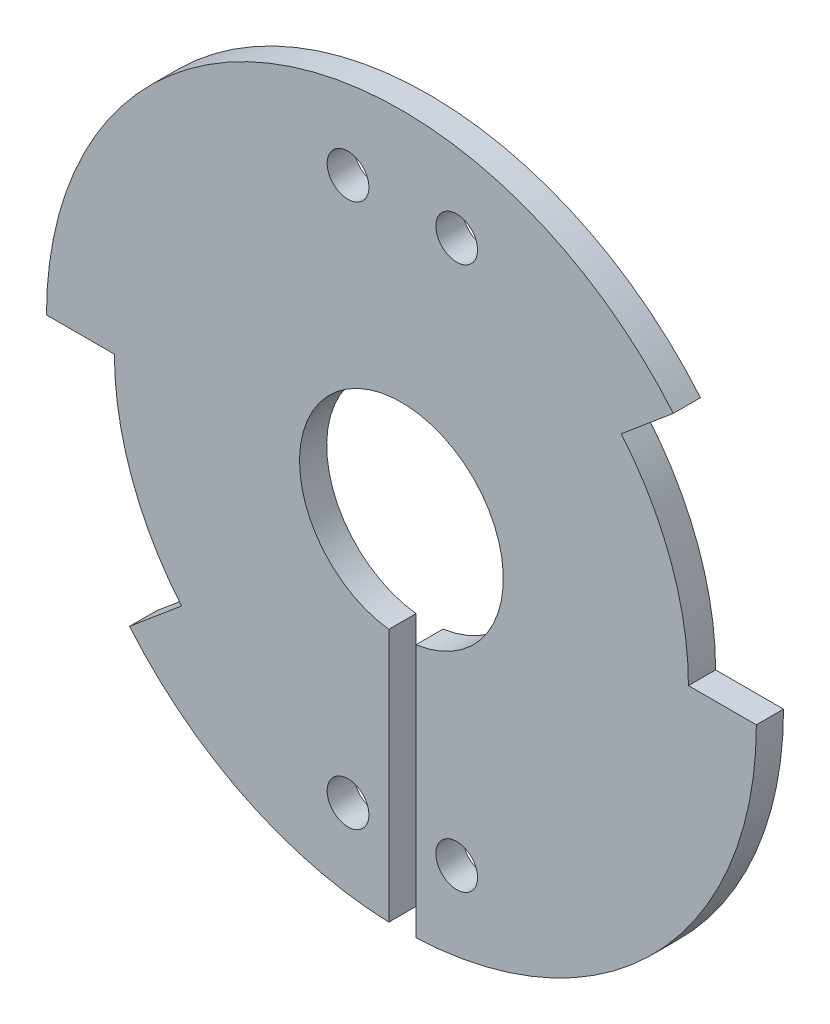
from build123d import *

# Parameters (mm, degrees)
SKETCH1_R           = 66.3575
BOSS_EXTRUDE1_DEPTH = 5.08
CUT_EXTRUDE1_REACH  = 95.981
SKETCH3_R           = 19.05
CUT_EXTRUDE2_REACH  = 95.981
SKETCH3_4_W         = 5.08
SKETCH3_4_H         = 59.193573399
SKETCH3_4_R         = 3.900616975


with BuildPart() as part:
    # Sketch1 → Boss-Extrude1 (new body)
    with BuildSketch(Plane.XY):
        Circle(SKETCH1_R)
    extrude(amount=BOSS_EXTRUDE1_DEPTH)

    # Sketch3 → Cut-Extrude1 (cut, up to next)
    with BuildSketch(Plane.XY, mode=Mode.PRIVATE) as cut_extrude1_sk1:
        Circle(SKETCH3_R)
    cut_extrude1_tool1 = extrude(cut_extrude1_sk1.sketch, amount=CUT_EXTRUDE1_REACH, mode=Mode.PRIVATE) & part.part
    add(cut_extrude1_tool1.solids().sort_by_distance((0, 0, 0))[0], mode=Mode.SUBTRACT)

    # Sketch3<4> → Cut-Extrude2 (cut, up to next)
    with BuildSketch(Plane.XY, mode=Mode.PRIVATE) as cut_extrude2_sk1:
        with Locations((0.17807752, -38.26186151)):
            Rectangle(SKETCH3_4_W, SKETCH3_4_H)
    cut_extrude2_tool1 = extrude(cut_extrude2_sk1.sketch, amount=CUT_EXTRUDE2_REACH, mode=Mode.PRIVATE) & part.part
    # Sketch3<4> → Cut-Extrude2 (cut, up to next)
    with BuildSketch(Plane.XY, mode=Mode.PRIVATE) as cut_extrude2_sk2:
        with Locations((10.33807752, -50.8)):
            Circle(SKETCH3_4_R)
    cut_extrude2_tool2 = extrude(cut_extrude2_sk2.sketch, amount=CUT_EXTRUDE2_REACH, mode=Mode.PRIVATE) & part.part
    # Sketch3<4> → Cut-Extrude2 (cut, up to next)
    with BuildSketch(Plane.XY, mode=Mode.PRIVATE) as cut_extrude2_sk3:
        with Locations((-9.98192248, -50.8)):
            Circle(SKETCH3_4_R)
    cut_extrude2_tool3 = extrude(cut_extrude2_sk3.sketch, amount=CUT_EXTRUDE2_REACH, mode=Mode.PRIVATE) & part.part
    # Sketch3<4> → Cut-Extrude2 (cut, up to next)
    with BuildSketch(Plane.XY, mode=Mode.PRIVATE) as cut_extrude2_sk4:
        with BuildLine():
            ThreePointArc((41.104029707, 34.490376167), (50.4215568, 18.35194584), (53.6575, 0))
            Line((53.6575, 0), (66.3575, 0))
            ThreePointArc((66.3575, 0), (62.355653084, 22.695601661), (50.832794134, 42.65377881))
            Line((50.832794134, 42.65377881), (41.104029707, 34.490376167))
        make_face()
    cut_extrude2_tool4 = extrude(cut_extrude2_sk4.sketch, amount=CUT_EXTRUDE2_REACH, mode=Mode.PRIVATE) & part.part
    # Sketch3<4> → Cut-Extrude2 (cut, up to next)
    with BuildSketch(Plane.XY, mode=Mode.PRIVATE) as cut_extrude2_sk5:
        with BuildLine():
            Line((-50.832794134, -42.65377881), (-41.104029707, -34.490376167))
            ThreePointArc((-41.104029707, -34.490376167), (-50.4215568, -18.35194584), (-53.6575, 0))
            Line((-53.6575, 0), (-66.3575, 0))
            ThreePointArc((-66.3575, 0), (-62.355653084, -22.695601661), (-50.832794134, -42.65377881))
        make_face()
    cut_extrude2_tool5 = extrude(cut_extrude2_sk5.sketch, amount=CUT_EXTRUDE2_REACH, mode=Mode.PRIVATE) & part.part
    # Sketch3<4> → Cut-Extrude2 (cut, up to next)
    with BuildSketch(Plane.XY, mode=Mode.PRIVATE) as cut_extrude2_sk6:
        with Locations((10.33807752, 50.8)):
            Circle(SKETCH3_4_R)
    cut_extrude2_tool6 = extrude(cut_extrude2_sk6.sketch, amount=CUT_EXTRUDE2_REACH, mode=Mode.PRIVATE) & part.part
    # Sketch3<4> → Cut-Extrude2 (cut, up to next)
    with BuildSketch(Plane.XY, mode=Mode.PRIVATE) as cut_extrude2_sk7:
        with Locations((-9.98192248, 50.8)):
            Circle(SKETCH3_4_R)
    cut_extrude2_tool7 = extrude(cut_extrude2_sk7.sketch, amount=CUT_EXTRUDE2_REACH, mode=Mode.PRIVATE) & part.part
    add(cut_extrude2_tool1.solids().sort_by_distance((0.178078, -38.261862, 0))[0], mode=Mode.SUBTRACT)
    add(cut_extrude2_tool2.solids().sort_by_distance((10.338078, -50.8, 0))[0], mode=Mode.SUBTRACT)
    add(cut_extrude2_tool3.solids().sort_by_distance((-9.981922, -50.8, 0))[0], mode=Mode.SUBTRACT)
    add(cut_extrude2_tool4.solids().sort_by_distance((55.456661, 20.184574, 0))[0], mode=Mode.SUBTRACT)
    add(cut_extrude2_tool5.solids().sort_by_distance((-55.456661, -20.184574, 0))[0], mode=Mode.SUBTRACT)
    add(cut_extrude2_tool6.solids().sort_by_distance((10.338078, 50.8, 0))[0], mode=Mode.SUBTRACT)
    add(cut_extrude2_tool7.solids().sort_by_distance((-9.981922, 50.8, 0))[0], mode=Mode.SUBTRACT)


solid = part.part
